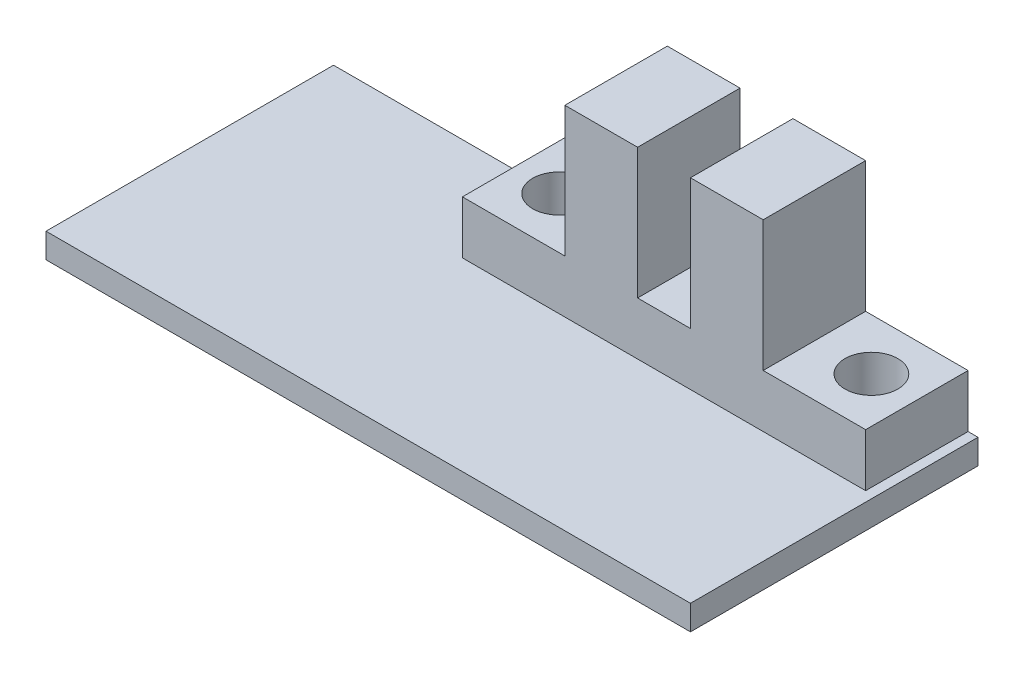
from build123d import *

# Parameters (mm, degrees)
SKETCH1_W           = 39
SKETCH1_H           = 17.4
BOSS_EXTRUDE1_DEPTH = 1.5
SKETCH2_W           = 24.4
SKETCH2_H           = 6.2
BOSS_EXTRUDE2_DEPTH = 3.2
SKETCH3_W           = 4.4
SKETCH3_H           = 6.2
BOSS_EXTRUDE3_DEPTH = 7.9
SKETCH4_R           = 1.6
CUT_EXTRUDE1_DEPTH  = 23.767301114


with BuildPart() as part:
    # Sketch1 → Boss-Extrude1 (new body)
    with BuildSketch(Plane(origin=(0, 0, 0), x_dir=(1, 0, 0), z_dir=(0, 1, 0))):
        Rectangle(SKETCH1_W, SKETCH1_H)
    extrude(amount=BOSS_EXTRUDE1_DEPTH)

    # Sketch2 → Boss-Extrude2 (add)
    with BuildSketch(Plane(origin=(0, 1.5, 0), x_dir=(1, 0, 0), z_dir=(0, 1, 0))):
        with Locations((6.7, 5.6)):
            Rectangle(SKETCH2_W, SKETCH2_H)
    extrude(amount=BOSS_EXTRUDE2_DEPTH)

    # Sketch3 → Boss-Extrude3 (add)
    with BuildSketch(Plane(origin=(0, 4.7, 0), x_dir=(1, 0, 0), z_dir=(0, 1, 0))):
        with Locations((2.9, 5.6)):
            Rectangle(SKETCH3_W, SKETCH3_H)
        with Locations((10.5, 5.6)):
            Rectangle(SKETCH3_W, SKETCH3_H)
    extrude(amount=BOSS_EXTRUDE3_DEPTH)

    # Sketch4 → Cut-Extrude1 (cut, through all)
    with BuildSketch(Plane(origin=(0, 4.7, 0), x_dir=(1, 0, 0), z_dir=(0, 1, 0))):
        with Locations(Location((-2.75, 5.6, 0), (0, 0, 270))):
            Circle(SKETCH4_R)
        with Locations(Location((16.15, 5.6, 0), (0, 0, 270))):
            Circle(SKETCH4_R)
    extrude(amount=-CUT_EXTRUDE1_DEPTH, mode=Mode.SUBTRACT)


solid = part.part
